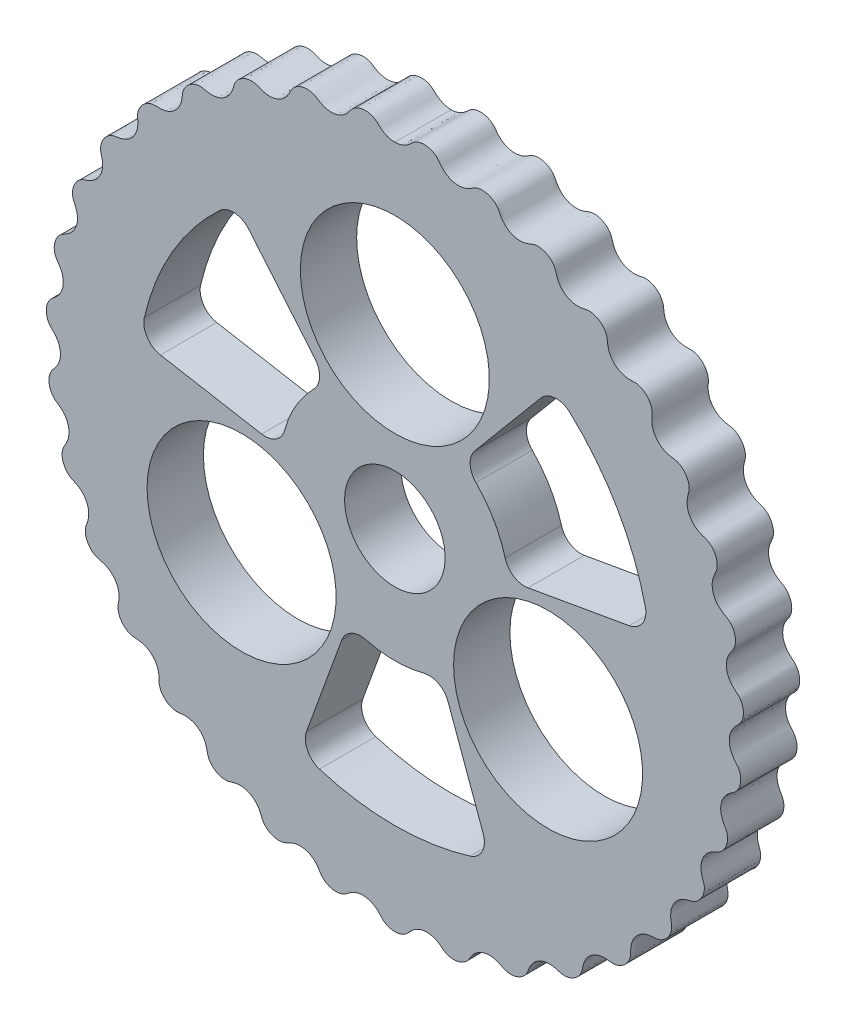
from build123d import *

# Parameters (mm, degrees)
BOSS_EXTRU_1_DEPTH           = 14
ENL_V_MAT_EXTRU_1_DEPTH      = 124.42138143
ENL_V_MAT_EXTRU_1_DEPTH_BACK = 124.42138143
ESQUISSE3_R                  = 12.5
ESQUISSE3_R_2                = 23.5


with BuildPart() as part:
    # Esquisse2 → Boss.-Extru.1 (new body)
    with BuildSketch(Plane.XY):
        with BuildLine():
            add(Edge.make_bspline(
                [(1e-09, 83.25), (0.040088824, 83.25), (0.120129435, 83.251061337), (0.267585323, 83.255837405), (0.462703618, 83.268563591), (0.645364707, 83.287627746), (0.825953715, 83.312999661), (1.053015758, 83.352548801), (1.323585204, 83.412444198), (1.633849565, 83.500181878), (1.981467864, 83.624321814), (2.319706006, 83.771485064), (2.662261899, 83.948181393), (3.005971372, 84.156358183), (3.348103017, 84.397162636), (3.685988397, 84.670610579), (4.008592319, 84.961802752), (4.321836079, 85.262578071), (4.647527428, 85.550888056), (5.00416229, 85.80082452), (5.420230989, 86.025743459), (5.895542579, 86.212908715), (6.56872817, 86.386645099), (7.441163645, 86.461499109), (8.31096741, 86.365542445), (9.139686188, 86.103782565), (9.742354143, 85.796005539), (10.150971365, 85.519911182), (10.493651783, 85.223730836), (10.774023962, 84.920522416), (11.02349314, 84.592216853), (11.266189819, 84.259279908), (11.583232815, 83.853055222), (11.978990072, 83.41447515), (12.475948016, 82.969917028), (13.236613444, 82.452632975), (14.231476492, 82.003960392), (15.316566452, 81.787292865), (16.425471427, 81.822980521), (17.371332617, 82.029422534), (18.031781326, 82.27473577), (18.590099136, 82.55866092), (19.058707362, 82.844515725), (19.424812003, 83.08639478), (19.797768015, 83.318657156), (20.194528645, 83.508944361), (20.646923696, 83.663433899), (21.152322405, 83.769311681), (21.852905271, 83.826753269), (22.733024109, 83.749513001), (23.579501632, 83.501749492), (24.354631314, 83.096153378), (24.903331276, 82.680179392), (25.270219184, 82.321521455), (25.570166919, 81.944583878), (25.804875176, 81.560289216), (26.0022721, 81.156523842), (26.200456977, 80.753476022), (26.417441773, 80.359742657), (26.659408377, 79.980820466), (27.043944341, 79.465530805), (27.623573402, 78.85957836), (28.494804468, 78.222841595), (29.550472496, 77.78603484), (30.539020285, 77.600802853), (31.351520301, 77.589184119), (31.930004105, 77.645832513), (32.444072119, 77.745989986), (32.893967914, 77.870153957), (33.33402857, 78.025317193), (33.765097494, 78.202941318), (34.194001399, 78.386098415), (34.6387147, 78.529805348), (35.134404455, 78.621743876), (35.674334892, 78.650260217), (36.403067544, 78.592270558), (37.275486637, 78.364225762), (38.205806208, 77.907245588), (38.961789042, 77.279081876), (39.44721498, 76.678331376), (39.736175831, 76.170073673), (39.895686332, 75.802983245), (40.017153344, 75.422023667), (40.123278131, 75.03704219), (40.266952736, 74.558710579), (40.52603309, 73.858369814), (40.998292492, 72.978406766), (41.799856099, 72.042062786), (42.915765728, 71.264158326), (44.088170393, 70.824770209), (45.098834121, 70.68453932), (45.907515146, 70.703534323), (46.503576132, 70.778964498), (46.975618019, 70.869128082), (47.443113881, 70.978260798), (47.916048892, 71.065998829), (48.43944974, 71.093542226), (49.003576105, 71.044012416), (49.755042598, 70.868238753), (50.610366574, 70.487726507), (51.467799376, 69.867511908), (52.111517426, 69.110718909), (52.484318801, 68.444428978), (52.68284929, 67.901497324), (52.77906692, 67.517497098), (52.83503762, 67.125910368), (52.870777297, 66.732510746), (52.923152924, 66.241358661), (53.043675087, 65.513213967), (53.333777617, 64.570142288), (53.93756528, 63.491699703), (54.775250645, 62.619966119), (55.630801731, 62.045619638), (56.36551236, 61.71532283), (56.923128601, 61.536890836), (57.447467895, 61.424449738), (57.930979273, 61.361975821), (58.417652562, 61.337451845), (58.904807507, 61.34335197), (59.390906455, 61.368187759), (59.878685487, 61.365811652), (60.398107488, 61.292640881), (60.936861168, 61.138826648), (61.62692939, 60.833061785), (62.368773024, 60.325452104), (63.070783729, 59.603766356), (63.599832645, 58.729641746), (63.864411541, 57.984269241), (63.966304107, 57.381112845), (63.984790029, 56.947011656), (63.969768225, 56.599995642), (63.940037008, 56.254191418), (63.913440028, 55.908139169), (63.89366939, 55.449772497), (63.907281987, 54.878978891), (63.995900239, 54.200692304), (64.209129067, 53.433584291), (64.591005855, 52.571629452), (65.20921762, 51.670333511), (66.0496679, 50.891803695), (66.977010041, 50.366395199), (67.765623933, 50.081199811), (68.363321294, 49.934399893), (68.848132122, 49.848790044), (69.335705709, 49.785087726), (69.821203649, 49.701160317), (70.326714826, 49.541891931), (70.837401665, 49.2974927), (71.472087998, 48.874778818), (72.167577664, 48.196074269), (72.704504093, 47.375491181), (73.050398197, 46.456289116), (73.180988144, 45.681862557), (73.192936086, 45.099857735), (73.123364105, 44.56054888), (72.995972368, 44.072709633), (72.863253803, 43.587050514), (72.756902125, 43.09415646), (72.669282446, 42.470109625), (72.645676872, 41.633534723), (72.792980571, 40.597385832), (73.246451733, 39.419706482), (74.026723602, 38.321842695), (74.945205601, 37.540235326), (75.877215276, 37.034082023), (76.730819728, 36.717716587), (77.466146094, 36.500920235), (78.227010447, 36.098063755), (78.94290159, 35.472632054), (79.582280339, 34.604590831), (79.985995888, 33.639305082), (80.161890124, 32.735499701), (80.167168005, 31.975334126), (80.092246376, 31.41625737), (79.949546775, 30.907612604), (79.754741271, 30.456911944), (79.539715603, 30.016508644), (79.343658601, 29.566803291), (79.13548163, 28.989859683), (78.977208113, 28.345311634), (78.896285201, 27.6362638), (78.924429639, 26.702747596), (79.101589924, 25.829390502), (79.4422354, 24.97534494), (79.946744448, 24.177461376), (80.468136684, 23.571467333), (80.985240033, 23.119511157), (81.454643896, 22.790508681), (81.848905188, 22.552451742), (82.153226287, 22.382870947), (82.459458217, 22.216808391), (82.759161309, 22.038729623), (83.113879052, 21.785019555), (83.564698722, 21.36810414), (84.044948452, 20.735775124), (84.482539297, 19.819008035), (84.69954113, 18.847352433), (84.72060122, 17.965362888), (84.608393743, 17.239032107), (84.45338458, 16.714643694), (84.243927867, 16.246368666), (83.992200308, 15.839401969), (83.70979725, 15.45442129), (83.437204302, 15.062284492), (83.187146159, 14.655095924), (82.967823992, 14.23035623), (82.76058648, 13.735848223), (82.585439327, 13.167212529), (82.433576786, 12.349587046), (82.424807012, 11.288794214), (82.683911379, 10.08245919), (83.25286204, 8.965055569), (83.878938115, 8.19727142), (84.420554291, 7.691678393), (84.802399117, 7.37549344), (85.112288731, 7.128236484), (85.410484748, 6.866174125), (85.680402423, 6.574613998), (86.027476828, 6.109583544), (86.38179352, 5.429952154), (86.661374327, 4.475010747), (86.708724976, 3.417349623), (86.557285936, 2.494770435), (86.293149173, 1.772499175), (86.026568983, 1.275144871), (85.718386004, 0.853504918), (85.387319394, 0.506870946), (85.03980125, 0.178128013), (84.704863354, -0.164064385), (84.313302332, -0.616928979), (83.850596733, -1.276908508), (83.407440773, -2.191982752), (83.124357518, -3.394471887), (83.144437709, -4.724873552), (83.459675641, -5.898887538), (83.912434778, -6.779301977), (84.351053976, -7.39691828), (84.687463888, -7.805611958), (84.966187651, -8.123982651), (85.234356775, -8.452174141), (85.466178553, -8.807518712), (85.670883953, -9.216198593), (85.837653454, -9.677064161), (85.98776599, -10.321989913), (86.046997252, -11.18412031), (85.935363479, -12.058352672), (85.649763823, -12.904302277), (85.299843782, -13.543163697), (84.981372193, -13.977711543), (84.634456039, -14.340996847), (84.272340311, -14.633852708), (83.885022582, -14.890732088), (83.500195172, -15.150932541), (83.128738169, -15.430574564), (82.777284268, -15.735109736), (82.410097918, -16.105949929), (82.043104054, -16.554016163), (81.602870496, -17.233571412), (81.189047964, -18.199749646), (80.959700668, -19.416788283), (81.048388588, -20.580355286), (81.294232045, -21.461273377), (81.548778859, -22.070318159), (81.729659438, -22.4375534), (81.929040397, -22.794886732), (82.138719094, -23.146055324), (82.338668927, -23.50328771), (82.502204312, -23.87923185), (82.635050876, -24.308707835), (82.724046056, -24.789997623), (82.765851459, -25.460257519), (82.677333698, -26.322526009), (82.420469218, -27.159041646), (82.004386069, -27.932062426), (81.573694516, -28.484349727), (81.209533758, -28.847842204), (80.833992576, -29.140890732), (80.459072082, -29.368332753), (80.061815494, -29.552559908), (79.659511492, -29.723896569), (79.263098568, -29.909282817), (78.877630401, -30.116676439), (78.442452719, -30.390664398), (77.972700817, -30.749743267), (77.357227429, -31.343029552), (76.711644179, -32.243524282), (76.218804032, -33.432674445), (76.072616869, -34.626592055), (76.143987091, -35.549226155), (76.279100857, -36.203086999), (76.388539038, -36.6022767), (76.519489397, -36.994763627), (76.663881626, -37.382271103), (76.802126975, -37.772313517), (76.903154417, -38.174291604), (76.963765591, -38.624872268), (76.970951564, -39.11982101), (76.897529174, -39.795118636), (76.660950158, -40.632541654), (76.263375149, -41.412085348), (75.72245722, -42.099226739), (75.209868062, -42.565111479), (74.794394294, -42.859137038), (74.379917505, -43.083461154), (73.977084979, -43.244948428), (73.558923633, -43.359302593), (73.136800287, -43.454735795), (72.612336729, -43.588870606), (71.852215082, -43.84232507), (70.902619737, -44.328733319), (69.883792778, -45.195235822), (69.157061734, -46.28056915), (68.76508556, -47.324874381), (68.594921359, -48.270625801), (68.567778889, -48.969519666), (68.613962003, -49.589691806), (68.694786044, -50.128766728), (68.773267701, -50.557413337), (68.836496503, -50.989230511), (68.850886571, -51.426003165), (68.81129709, -51.899001144), (68.707087309, -52.400986137), (68.482323379, -53.061598032), (68.065278708, -53.832841019), (67.507335071, -54.506959451), (66.834400533, -55.055147385), (66.248760448, -55.389010238), (65.795647233, -55.578972256), (65.361860162, -55.703145356), (64.956181538, -55.772161862), (64.443866036, -55.807373871), (63.931172762, -55.827974159), (63.420145107, -55.884524011), (62.668834416, -56.030036466), (61.796234483, -56.315916411), (60.777986256, -56.890035252), (59.893659002, -57.758519579), (59.321571212, -58.638865687), (59.002346622, -59.379857825), (58.834055279, -59.931858669), (58.729559464, -60.441272399), (58.671101197, -60.900926585), (58.643855067, -61.363419424), (58.639589466, -61.826248627), (58.637608794, -62.289393757), (58.590409594, -62.751064883), (58.47655898, -63.23844213), (58.288134252, -63.741108028), (57.947060621, -64.381759389), (57.397609467, -65.084028086), (56.72844525, -65.657465727), (55.974494281, -66.081886689), (55.350535039, -66.310959662), (54.871806721, -66.424375627), (54.415980045, -66.476915586), (53.990077178, -66.477027239), (53.567027886, -66.43223532), (53.146149552, -66.374980758), (52.617547652, -66.320457712), (52.024831468, -66.302552842), (51.371538855, -66.352910193), (50.506679972, -66.533412989), (49.559166069, -66.89955859), (48.702108462, -67.459958152), (47.983129465, -68.187220398), (47.523373132, -68.84297049), (47.246964686, -69.348229432), (47.041025691, -69.827817194), (46.890269659, -70.271287638), (46.771964625, -70.724311575), (46.678819225, -71.182929082), (46.597211298, -71.643604056), (46.481172827, -72.097836795), (46.292138209, -72.571163752), (46.021824306, -73.050075572), (45.568761197, -73.645903655), (44.890222196, -74.263849266), (43.98905763, -74.797689653), (42.94746495, -75.115435619), (42.077464738, -75.177152086), (41.399248352, -75.086743744), (40.919544318, -74.952994273), (40.541050674, -74.830321547), (40.064807021, -74.686100724), (39.34103762, -74.514604771), (38.350893535, -74.419455578), (37.074520732, -74.571442192), (35.888721468, -75.052607731), (34.975698329, -75.699195424), (34.364450703, -76.334250239), (33.996294353, -76.821705461), (33.717733349, -77.275455177), (33.509077341, -77.679329947), (33.327021242, -78.095806944), (33.164723663, -78.519896193), (33.001563278, -78.94406372), (32.796656033, -79.350658682), (32.522823625, -79.758336134), (32.176119273, -80.155081713), (31.642523598, -80.627231096), (30.892052867, -81.090036542), (29.939862838, -81.443918664), (28.982545679, -81.56293214), (28.223855785, -81.509746348), (27.662910254, -81.379274614), (27.29013254, -81.250373055), (26.933001632, -81.083581168), (26.586085422, -80.897631599), (26.149349906, -80.67078978), (25.478937262, -80.369066932), (24.537228785, -80.088216925), (23.307663963, -79.990838846), (22.118338742, -80.201733299), (21.164294245, -80.593602961), (20.375220631, -81.087273774), (19.832279629, -81.546660398), (19.385274321, -82.034157122), (19.021479045, -82.525340001), (18.756127919, -82.935963458), (18.508085715, -83.356669889), (18.23834038, -83.765058711), (17.891785818, -84.16123741), (17.466514062, -84.529044784), (16.830210216, -84.939795759), (16.063344263, -85.254591828), (15.22012652, -85.433382801), (14.32799274, -85.451837247), (13.568915493, -85.344226448), (12.872967316, -85.118520656), (12.262220894, -84.783351141), (11.749872351, -84.371212326), (11.259348298, -83.991245968), (10.73794288, -83.651801139), (10.185577467, -83.366248058), (9.605089875, -83.142087795), (9.003129514, -82.984559577), (8.214241107, -82.872388745), (7.405176449, -82.88676343), (6.599602357, -83.034120338), (5.741072926, -83.342141719), (5.114760944, -83.673731768), (4.568925645, -84.060173336), (4.099612111, -84.477542208), (3.749044233, -84.837510854), (3.418552905, -85.215066553), (3.081505747, -85.587765386), (2.731768166, -85.886441779), (2.386291749, -86.116835583), (2.059146739, -86.292339371), (1.759522327, -86.424357783), (1.489580283, -86.520234495), (1.2539302, -86.588522689), (1.015010104, -86.645781378), (0.813542031, -86.684340968), (0.614912199, -86.713791418), (0.408551575, -86.734163691), (0.233446381, -86.745023828), (0.106617179, -86.749095241), (0.035572526, -86.75), (0, -86.75)],
                knots=[0.066501337, 0.066501337, 0.066501337, 0.066501337, 0.066501337, 0.067030786, 0.067560235, 0.068089684, 0.068619133, 0.069148582, 0.069678031, 0.070736929, 0.071795827, 0.072854725, 0.073913623, 0.074972521, 0.076220363, 0.077468205, 0.078716047, 0.079963889, 0.081211731, 0.082459573, 0.083707415, 0.084955257, 0.086634783, 0.088314308, 0.091673359, 0.09495824, 0.09660068, 0.098243121, 0.099426856, 0.100610592, 0.101794327, 0.102978063, 0.104161798, 0.105345534, 0.107713005, 0.109756077, 0.11179915, 0.115885295, 0.12016899, 0.122310837, 0.124452685, 0.126974339, 0.128235166, 0.129495993, 0.13075682, 0.132017647, 0.133278474, 0.134539302, 0.136237378, 0.137935454, 0.141331606, 0.144630776, 0.146280361, 0.147929945, 0.149220372, 0.1505108, 0.151801227, 0.153091654, 0.154382081, 0.155672508, 0.156962935, 0.158253362, 0.161761518, 0.165269673, 0.169256048, 0.171249236, 0.173242423, 0.174581734, 0.175921046, 0.177260357, 0.178599668, 0.179938979, 0.181278291, 0.182617602, 0.183956913, 0.185715154, 0.187473395, 0.190989878, 0.194252137, 0.197514396, 0.19866182, 0.199809244, 0.200956667, 0.202104091, 0.203251515, 0.204398938, 0.206693785, 0.210674514, 0.214655242, 0.218406661, 0.222158079, 0.224917175, 0.226296724, 0.227676272, 0.22905582, 0.230435368, 0.231814916, 0.233194465, 0.235057963, 0.236921461, 0.240648458, 0.243873619, 0.247098781, 0.248233673, 0.249368566, 0.250503458, 0.25163835, 0.252773242, 0.253908134, 0.256177919, 0.260110274, 0.26404263, 0.267959112, 0.269917354, 0.271875595, 0.273274219, 0.274672842, 0.276071466, 0.277470089, 0.278868713, 0.280267337, 0.28166596, 0.283064584, 0.284875183, 0.286685782, 0.29030698, 0.293323427, 0.296339874, 0.298333861, 0.299330855, 0.300327848, 0.301324842, 0.302321835, 0.303318829, 0.304315822, 0.306594796, 0.308873769, 0.311152743, 0.313431716, 0.317387723, 0.32134373, 0.324169909, 0.325582999, 0.326996088, 0.328409178, 0.329822268, 0.331235357, 0.332648447, 0.334477645, 0.336306843, 0.33996524, 0.343736076, 0.345621494, 0.347506912, 0.348953761, 0.35040061, 0.351847459, 0.353294308, 0.354741157, 0.356188006, 0.359081704, 0.362879335, 0.366676967, 0.370537807, 0.374398648, 0.376596104, 0.37879356, 0.380991016, 0.383188472, 0.386406137, 0.389623802, 0.393269885, 0.395092927, 0.396915969, 0.398324235, 0.399732501, 0.401140767, 0.402549033, 0.403957299, 0.405365565, 0.408182097, 0.410153537, 0.412124976, 0.416067856, 0.418355936, 0.420644016, 0.422932097, 0.425220177, 0.426220887, 0.427221596, 0.428222306, 0.429223015, 0.430223725, 0.431224434, 0.433225853, 0.436253956, 0.439282058, 0.442804394, 0.444565561, 0.446326729, 0.447698255, 0.44906978, 0.450441306, 0.451812832, 0.453184357, 0.454555883, 0.455927408, 0.457298934, 0.459338214, 0.461377494, 0.465456054, 0.469404559, 0.473353064, 0.475631132, 0.476770166, 0.4779092, 0.479048235, 0.480187269, 0.481326303, 0.482465337, 0.48570288, 0.488940423, 0.49265461, 0.494511704, 0.496368797, 0.49774343, 0.499118063, 0.500492695, 0.501867328, 0.503241961, 0.504616594, 0.507365859, 0.511104367, 0.514842875, 0.518670795, 0.522498716, 0.524930609, 0.526146555, 0.527362502, 0.528578448, 0.529794394, 0.531010341, 0.532226287, 0.533819427, 0.535412567, 0.538598846, 0.542102883, 0.543854902, 0.545606921, 0.546941465, 0.54827601, 0.549610554, 0.550945099, 0.552279643, 0.553614188, 0.554948732, 0.556283277, 0.558269429, 0.560255581, 0.564227886, 0.568282181, 0.572336476, 0.573511572, 0.574686668, 0.575861764, 0.57703686, 0.578211956, 0.579387052, 0.580562148, 0.581737244, 0.583367239, 0.584997234, 0.588257225, 0.591641053, 0.593332967, 0.595024881, 0.596281361, 0.59753784, 0.59879432, 0.600050799, 0.601307279, 0.602563758, 0.603820238, 0.605076717, 0.607210573, 0.609344429, 0.61361214, 0.617714162, 0.621816183, 0.623004276, 0.62419237, 0.625380463, 0.626568556, 0.627756649, 0.628944742, 0.630132836, 0.631320929, 0.632969564, 0.6346182, 0.637915471, 0.641262075, 0.642935376, 0.644608678, 0.645852233, 0.647095787, 0.648339342, 0.649582897, 0.650826452, 0.652070006, 0.654557116, 0.658776575, 0.662996034, 0.667247711, 0.669373549, 0.671499388, 0.674003689, 0.67525584, 0.67650799, 0.677760141, 0.679012292, 0.680264442, 0.681516593, 0.683202323, 0.684888053, 0.688259513, 0.691531966, 0.693168193, 0.694804419, 0.695983822, 0.697163225, 0.698342627, 0.69952203, 0.701880835, 0.703060238, 0.70423964, 0.708309876, 0.712380112, 0.716338335, 0.718317447, 0.720296558, 0.721626341, 0.722956124, 0.724285907, 0.72561569, 0.726945472, 0.728275255, 0.729605038, 0.730934821, 0.732680588, 0.734426356, 0.737917891, 0.741116125, 0.742715242, 0.744314359, 0.745534974, 0.746755589, 0.747976204, 0.74919682, 0.750417435, 0.75163805, 0.75407928, 0.756000656, 0.757922032, 0.761764784, 0.76568184, 0.767640368, 0.769598896, 0.770942863, 0.772286829, 0.773630795, 0.774974762, 0.776318728, 0.777662694, 0.77900666, 0.780350627, 0.782157021, 0.783963414, 0.787576202, 0.790826112, 0.794076022, 0.796362446, 0.797505657, 0.798648869, 0.799792081, 0.800935292, 0.803221716, 0.807186345, 0.811150975, 0.815545486, 0.817742741, 0.819939996, 0.821244698, 0.822549399, 0.8238541, 0.825158801, 0.826463502, 0.827768204, 0.829072905, 0.830377606, 0.832091813, 0.833806021, 0.837234435, 0.840447205, 0.843659974, 0.844790762, 0.845921549, 0.847052336, 0.848183123, 0.84931391, 0.850444698, 0.852706272, 0.856622453, 0.860538634, 0.864468338, 0.86643319, 0.868398042, 0.871204929, 0.872608373, 0.874011817, 0.87541526, 0.876818704, 0.878222148, 0.879625591, 0.881442433, 0.883259274, 0.886892958, 0.889085186, 0.891277414, 0.893469642, 0.895661871, 0.897445183, 0.899228495, 0.901011808, 0.90279512, 0.904578432, 0.906361744, 0.908145057, 0.909928369, 0.913713678, 0.915606332, 0.917498987, 0.920382828, 0.921824749, 0.92326667, 0.924708591, 0.926150512, 0.927592432, 0.929034353, 0.929973959, 0.930913564, 0.93185317, 0.932792775, 0.933262578, 0.933732381, 0.934671986, 0.935141789, 0.935611592, 0.936081395, 0.936551197, 0.936551197, 0.936551197, 0.936551197, 0.936551197], degree=4))
            add(Edge.make_bspline(
                [(1e-09, 83.25), (-0.040088823, 83.25), (-0.120129435, 83.251061337), (-0.267585323, 83.255837405), (-0.462703617, 83.268563591), (-0.645364706, 83.287627746), (-0.825953715, 83.312999661), (-1.053015757, 83.352548801), (-1.323585203, 83.412444198), (-1.633849564, 83.500181878), (-1.981467864, 83.624321814), (-2.319706005, 83.771485064), (-2.662261898, 83.948181393), (-3.005971371, 84.156358183), (-3.348103016, 84.397162636), (-3.685988396, 84.670610579), (-4.008592318, 84.961802752), (-4.321836079, 85.262578071), (-4.647527428, 85.550888056), (-5.004162289, 85.80082452), (-5.420230989, 86.025743459), (-5.895542578, 86.212908715), (-6.568728169, 86.386645099), (-7.441163644, 86.461499109), (-8.310967409, 86.365542445), (-9.139686187, 86.103782565), (-9.742354142, 85.796005539), (-10.150971364, 85.519911182), (-10.493651782, 85.223730836), (-10.774023961, 84.920522416), (-11.023493139, 84.592216853), (-11.266189818, 84.259279908), (-11.583232814, 83.853055222), (-11.978990071, 83.41447515), (-12.475948015, 82.969917028), (-13.236613443, 82.452632975), (-14.231476491, 82.003960392), (-15.316566452, 81.787292865), (-16.425471427, 81.822980521), (-17.371332616, 82.029422534), (-18.031781325, 82.27473577), (-18.590099135, 82.55866092), (-19.058707361, 82.844515725), (-19.424812002, 83.08639478), (-19.797768014, 83.318657156), (-20.194528644, 83.508944361), (-20.646923695, 83.663433899), (-21.152322404, 83.769311681), (-21.85290527, 83.826753269), (-22.733024108, 83.749513001), (-23.579501631, 83.501749492), (-24.354631313, 83.096153378), (-24.903331276, 82.680179392), (-25.270219183, 82.321521455), (-25.570166918, 81.944583878), (-25.804875175, 81.560289216), (-26.0022721, 81.156523842), (-26.200456976, 80.753476022), (-26.417441772, 80.359742657), (-26.659408377, 79.980820466), (-27.04394434, 79.465530805), (-27.623573401, 78.85957836), (-28.494804467, 78.222841595), (-29.550472495, 77.78603484), (-30.539020284, 77.600802853), (-31.3515203, 77.589184119), (-31.930004105, 77.645832513), (-32.444072118, 77.745989986), (-32.893967913, 77.870153957), (-33.334028569, 78.025317193), (-33.765097493, 78.202941318), (-34.194001399, 78.386098415), (-34.638714699, 78.529805348), (-35.134404454, 78.621743876), (-35.674334891, 78.650260217), (-36.403067543, 78.592270558), (-37.275486636, 78.364225762), (-38.205806207, 77.907245588), (-38.961789041, 77.279081876), (-39.447214979, 76.678331376), (-39.73617583, 76.170073673), (-39.895686331, 75.802983245), (-40.017153343, 75.422023667), (-40.12327813, 75.03704219), (-40.266952735, 74.558710579), (-40.52603309, 73.858369814), (-40.998292492, 72.978406766), (-41.799856098, 72.042062786), (-42.915765728, 71.264158326), (-44.088170392, 70.824770209), (-45.09883412, 70.68453932), (-45.907515145, 70.703534323), (-46.503576131, 70.778964498), (-46.975618018, 70.869128082), (-47.443113881, 70.978260798), (-47.916048891, 71.065998829), (-48.439449739, 71.093542226), (-49.003576104, 71.044012416), (-49.755042597, 70.868238753), (-50.610366574, 70.487726508), (-51.467799375, 69.867511908), (-52.111517426, 69.110718909), (-52.4843188, 68.444428978), (-52.68284929, 67.901497324), (-52.779066919, 67.517497098), (-52.835037619, 67.125910368), (-52.870777296, 66.732510746), (-52.923152923, 66.241358661), (-53.043675087, 65.513213967), (-53.333777617, 64.570142288), (-53.937565279, 63.491699703), (-54.775250644, 62.619966119), (-55.63080173, 62.045619638), (-56.365512359, 61.71532283), (-56.9231286, 61.536890836), (-57.447467894, 61.424449738), (-57.930979272, 61.361975821), (-58.417652561, 61.337451845), (-58.904807506, 61.34335197), (-59.390906454, 61.368187759), (-59.878685487, 61.365811653), (-60.398107487, 61.292640881), (-60.936861167, 61.138826648), (-61.626929389, 60.833061785), (-62.368773023, 60.325452104), (-63.070783728, 59.603766356), (-63.599832644, 58.729641746), (-63.864411541, 57.984269241), (-63.966304106, 57.381112845), (-63.984790028, 56.947011656), (-63.969768224, 56.599995642), (-63.940037007, 56.254191418), (-63.913440027, 55.908139169), (-63.893669389, 55.449772497), (-63.907281986, 54.878978891), (-63.995900238, 54.200692304), (-64.209129066, 53.433584291), (-64.591005854, 52.571629452), (-65.209217619, 51.670333511), (-66.049667899, 50.891803695), (-66.97701004, 50.366395199), (-67.765623932, 50.081199811), (-68.363321293, 49.934399893), (-68.848132121, 49.848790044), (-69.335705708, 49.785087726), (-69.821203648, 49.701160317), (-70.326714825, 49.541891931), (-70.837401665, 49.2974927), (-71.472087997, 48.874778818), (-72.167577663, 48.19607427), (-72.704504092, 47.375491181), (-73.050398196, 46.456289116), (-73.180988143, 45.681862557), (-73.192936085, 45.099857735), (-73.123364105, 44.56054888), (-72.995972367, 44.072709633), (-72.863253802, 43.587050514), (-72.756902124, 43.09415646), (-72.669282446, 42.470109625), (-72.645676871, 41.633534723), (-72.79298057, 40.597385832), (-73.246451732, 39.419706482), (-74.026723601, 38.321842695), (-74.9452056, 37.540235326), (-75.877215276, 37.034082023), (-76.730819727, 36.717716587), (-77.466146093, 36.500920235), (-78.227010446, 36.098063755), (-78.942901589, 35.472632054), (-79.582280338, 34.604590831), (-79.985995887, 33.639305083), (-80.161890123, 32.735499701), (-80.167168004, 31.975334126), (-80.092246375, 31.41625737), (-79.949546774, 30.907612604), (-79.75474127, 30.456911945), (-79.539715602, 30.016508644), (-79.3436586, 29.566803291), (-79.135481629, 28.989859683), (-78.977208112, 28.345311634), (-78.896285201, 27.636263801), (-78.924429638, 26.702747596), (-79.101589924, 25.829390502), (-79.442235399, 24.97534494), (-79.946744448, 24.177461376), (-80.468136683, 23.571467333), (-80.985240032, 23.119511157), (-81.454643895, 22.790508681), (-81.848905187, 22.552451742), (-82.153226286, 22.382870947), (-82.459458217, 22.216808391), (-82.759161308, 22.038729624), (-83.113879051, 21.785019555), (-83.564698721, 21.368104141), (-84.044948451, 20.735775124), (-84.482539296, 19.819008035), (-84.699541129, 18.847352433), (-84.720601219, 17.965362888), (-84.608393742, 17.239032107), (-84.453384579, 16.714643694), (-84.243927866, 16.246368667), (-83.992200308, 15.839401969), (-83.709797249, 15.45442129), (-83.437204301, 15.062284492), (-83.187146158, 14.655095924), (-82.967823992, 14.23035623), (-82.760586479, 13.735848223), (-82.585439327, 13.167212529), (-82.433576786, 12.349587046), (-82.424807012, 11.288794214), (-82.683911378, 10.08245919), (-83.252862039, 8.965055569), (-83.878938115, 8.19727142), (-84.42055429, 7.691678394), (-84.802399116, 7.37549344), (-85.11228873, 7.128236484), (-85.410484747, 6.866174125), (-85.680402422, 6.574613998), (-86.027476827, 6.109583544), (-86.381793519, 5.429952154), (-86.661374326, 4.475010747), (-86.708724975, 3.417349623), (-86.557285936, 2.494770435), (-86.293149172, 1.772499175), (-86.026568982, 1.275144871), (-85.718386004, 0.853504918), (-85.387319393, 0.506870946), (-85.039801249, 0.178128013), (-84.704863353, -0.164064385), (-84.313302331, -0.616928979), (-83.850596732, -1.276908508), (-83.407440773, -2.191982752), (-83.124357517, -3.394471887), (-83.144437708, -4.724873552), (-83.45967564, -5.898887538), (-83.912434777, -6.779301977), (-84.351053975, -7.39691828), (-84.687463888, -7.805611957), (-84.96618765, -8.123982651), (-85.234356775, -8.452174141), (-85.466178552, -8.807518712), (-85.670883952, -9.216198593), (-85.837653453, -9.677064161), (-85.98776599, -10.321989913), (-86.046997251, -11.184120309), (-85.935363479, -12.058352672), (-85.649763822, -12.904302277), (-85.299843781, -13.543163697), (-84.981372193, -13.977711543), (-84.634456038, -14.340996847), (-84.272340311, -14.633852708), (-83.885022581, -14.890732088), (-83.500195171, -15.150932541), (-83.128738168, -15.430574564), (-82.777284267, -15.735109736), (-82.410097917, -16.105949929), (-82.043104053, -16.554016163), (-81.602870495, -17.233571412), (-81.189047964, -18.199749646), (-80.959700667, -19.416788283), (-81.048388587, -20.580355286), (-81.294232044, -21.461273377), (-81.548778858, -22.070318159), (-81.729659437, -22.4375534), (-81.929040397, -22.794886732), (-82.138719093, -23.146055324), (-82.338668926, -23.503287709), (-82.502204311, -23.87923185), (-82.635050875, -24.308707835), (-82.724046055, -24.789997623), (-82.765851458, -25.460257518), (-82.677333697, -26.322526009), (-82.420469217, -27.159041646), (-82.004386068, -27.932062426), (-81.573694516, -28.484349727), (-81.209533757, -28.847842204), (-80.833992575, -29.140890732), (-80.459072081, -29.368332753), (-80.061815493, -29.552559908), (-79.659511491, -29.723896568), (-79.263098567, -29.909282817), (-78.8776304, -30.116676439), (-78.442452718, -30.390664398), (-77.972700816, -30.749743267), (-77.357227428, -31.343029551), (-76.711644178, -32.243524282), (-76.218804031, -33.432674445), (-76.072616869, -34.626592055), (-76.14398709, -35.549226155), (-76.279100856, -36.203086999), (-76.388539037, -36.6022767), (-76.519489397, -36.994763627), (-76.663881625, -37.382271103), (-76.802126974, -37.772313517), (-76.903154416, -38.174291604), (-76.96376559, -38.624872268), (-76.970951564, -39.11982101), (-76.897529173, -39.795118636), (-76.660950157, -40.632541654), (-76.263375148, -41.412085348), (-75.722457219, -42.099226739), (-75.209868061, -42.565111479), (-74.794394293, -42.859137038), (-74.379917505, -43.083461154), (-73.977084978, -43.244948428), (-73.558923632, -43.359302593), (-73.136800286, -43.454735795), (-72.612336728, -43.588870606), (-71.852215081, -43.84232507), (-70.902619737, -44.328733319), (-69.883792777, -45.195235822), (-69.157061733, -46.28056915), (-68.765085559, -47.324874381), (-68.594921358, -48.270625801), (-68.567778889, -48.969519666), (-68.613962003, -49.589691806), (-68.694786043, -50.128766728), (-68.773267701, -50.557413337), (-68.836496502, -50.989230511), (-68.85088657, -51.426003165), (-68.811297089, -51.899001144), (-68.707087308, -52.400986137), (-68.482323378, -53.061598032), (-68.065278707, -53.832841019), (-67.50733507, -54.506959451), (-66.834400533, -55.055147385), (-66.248760448, -55.389010238), (-65.795647232, -55.578972256), (-65.361860161, -55.703145356), (-64.956181537, -55.772161862), (-64.443866035, -55.807373871), (-63.931172762, -55.827974159), (-63.420145107, -55.884524011), (-62.668834416, -56.030036466), (-61.796234483, -56.315916411), (-60.777986255, -56.890035252), (-59.893659001, -57.758519579), (-59.321571212, -58.638865687), (-59.002346622, -59.379857825), (-58.834055278, -59.931858669), (-58.729559463, -60.441272399), (-58.671101196, -60.900926585), (-58.643855066, -61.363419424), (-58.639589466, -61.826248627), (-58.637608794, -62.289393757), (-58.590409593, -62.751064883), (-58.476558979, -63.23844213), (-58.288134251, -63.741108028), (-57.94706062, -64.381759389), (-57.397609466, -65.084028086), (-56.72844525, -65.657465727), (-55.97449428, -66.081886689), (-55.350535039, -66.310959662), (-54.87180672, -66.424375627), (-54.415980044, -66.476915586), (-53.990077178, -66.477027239), (-53.567027885, -66.432235319), (-53.146149551, -66.374980758), (-52.617547651, -66.320457712), (-52.024831468, -66.302552842), (-51.371538854, -66.352910193), (-50.506679971, -66.533412989), (-49.559166069, -66.89955859), (-48.702108461, -67.459958152), (-47.983129464, -68.187220397), (-47.523373131, -68.84297049), (-47.246964685, -69.348229432), (-47.04102569, -69.827817194), (-46.890269658, -70.271287638), (-46.771964624, -70.724311575), (-46.678819224, -71.182929082), (-46.597211297, -71.643604056), (-46.481172826, -72.097836795), (-46.292138209, -72.571163752), (-46.021824306, -73.050075572), (-45.568761197, -73.645903655), (-44.890222196, -74.263849266), (-43.989057629, -74.797689653), (-42.94746495, -75.115435619), (-42.077464737, -75.177152086), (-41.399248352, -75.086743744), (-40.919544317, -74.952994273), (-40.541050673, -74.830321547), (-40.064807021, -74.686100724), (-39.341037619, -74.514604771), (-38.350893534, -74.419455578), (-37.074520731, -74.571442192), (-35.888721468, -75.052607731), (-34.975698329, -75.699195424), (-34.364450702, -76.334250239), (-33.996294352, -76.821705461), (-33.717733348, -77.275455177), (-33.50907734, -77.679329947), (-33.327021241, -78.095806944), (-33.164723662, -78.519896193), (-33.001563278, -78.94406372), (-32.796656032, -79.350658682), (-32.522823625, -79.758336134), (-32.176119273, -80.155081713), (-31.642523598, -80.627231096), (-30.892052867, -81.090036542), (-29.939862837, -81.443918664), (-28.982545678, -81.562932139), (-28.223855784, -81.509746348), (-27.662910253, -81.379274614), (-27.290132539, -81.250373055), (-26.933001631, -81.083581168), (-26.586085422, -80.897631599), (-26.149349905, -80.67078978), (-25.478937261, -80.369066932), (-24.537228785, -80.088216925), (-23.307663963, -79.990838846), (-22.118338741, -80.201733299), (-21.164294245, -80.593602961), (-20.37522063, -81.087273774), (-19.832279628, -81.546660398), (-19.385274321, -82.034157122), (-19.021479044, -82.525340001), (-18.756127919, -82.935963458), (-18.508085714, -83.356669889), (-18.238340379, -83.765058711), (-17.891785818, -84.16123741), (-17.466514061, -84.529044784), (-16.830210216, -84.939795759), (-16.063344263, -85.254591828), (-15.220126519, -85.433382801), (-14.32799274, -85.451837247), (-13.568915492, -85.344226448), (-12.872967315, -85.118520656), (-12.262220894, -84.783351141), (-11.749872351, -84.371212326), (-11.259348297, -83.991245968), (-10.737942879, -83.651801139), (-10.185577466, -83.366248058), (-9.605089874, -83.142087795), (-9.003129513, -82.984559577), (-8.214241106, -82.872388745), (-7.405176448, -82.88676343), (-6.599602356, -83.034120338), (-5.741072925, -83.342141719), (-5.114760943, -83.673731768), (-4.568925644, -84.060173336), (-4.099612111, -84.477542208), (-3.749044232, -84.837510854), (-3.418552904, -85.215066553), (-3.081505747, -85.587765386), (-2.731768165, -85.886441779), (-2.386291749, -86.116835583), (-2.059146738, -86.292339371), (-1.759522326, -86.424357783), (-1.489580282, -86.520234495), (-1.2539302, -86.588522689), (-1.015010103, -86.645781378), (-0.813542031, -86.684340968), (-0.614912199, -86.713791418), (-0.408551574, -86.734163691), (-0.23344638, -86.745023828), (-0.106617179, -86.749095241), (-0.035572526, -86.75), (0, -86.75)],
                knots=[0.066501337, 0.066501337, 0.066501337, 0.066501337, 0.066501337, 0.067030786, 0.067560235, 0.068089684, 0.068619133, 0.069148582, 0.069678031, 0.070736929, 0.071795827, 0.072854725, 0.073913623, 0.074972521, 0.076220363, 0.077468205, 0.078716047, 0.079963889, 0.081211731, 0.082459573, 0.083707415, 0.084955257, 0.086634783, 0.088314308, 0.091673359, 0.09495824, 0.09660068, 0.098243121, 0.099426856, 0.100610592, 0.101794327, 0.102978063, 0.104161798, 0.105345534, 0.107713005, 0.109756077, 0.11179915, 0.115885295, 0.12016899, 0.122310837, 0.124452685, 0.126974339, 0.128235166, 0.129495993, 0.13075682, 0.132017647, 0.133278474, 0.134539302, 0.136237378, 0.137935454, 0.141331606, 0.144630776, 0.146280361, 0.147929945, 0.149220372, 0.1505108, 0.151801227, 0.153091654, 0.154382081, 0.155672508, 0.156962935, 0.158253362, 0.161761518, 0.165269673, 0.169256048, 0.171249236, 0.173242423, 0.174581734, 0.175921046, 0.177260357, 0.178599668, 0.179938979, 0.181278291, 0.182617602, 0.183956913, 0.185715154, 0.187473395, 0.190989878, 0.194252137, 0.197514396, 0.19866182, 0.199809244, 0.200956667, 0.202104091, 0.203251515, 0.204398938, 0.206693785, 0.210674514, 0.214655242, 0.218406661, 0.222158079, 0.224917175, 0.226296724, 0.227676272, 0.22905582, 0.230435368, 0.231814916, 0.233194465, 0.235057963, 0.236921461, 0.240648458, 0.243873619, 0.247098781, 0.248233673, 0.249368566, 0.250503458, 0.25163835, 0.252773242, 0.253908134, 0.256177919, 0.260110274, 0.26404263, 0.267959112, 0.269917354, 0.271875595, 0.273274219, 0.274672842, 0.276071466, 0.277470089, 0.278868713, 0.280267337, 0.28166596, 0.283064584, 0.284875183, 0.286685782, 0.29030698, 0.293323427, 0.296339874, 0.298333861, 0.299330855, 0.300327848, 0.301324842, 0.302321835, 0.303318829, 0.304315822, 0.306594796, 0.308873769, 0.311152743, 0.313431716, 0.317387723, 0.32134373, 0.324169909, 0.325582999, 0.326996088, 0.328409178, 0.329822268, 0.331235357, 0.332648447, 0.334477645, 0.336306843, 0.33996524, 0.343736076, 0.345621494, 0.347506912, 0.348953761, 0.35040061, 0.351847459, 0.353294308, 0.354741157, 0.356188006, 0.359081704, 0.362879335, 0.366676967, 0.370537807, 0.374398648, 0.376596104, 0.37879356, 0.380991016, 0.383188472, 0.386406137, 0.389623802, 0.393269885, 0.395092927, 0.396915969, 0.398324235, 0.399732501, 0.401140767, 0.402549033, 0.403957299, 0.405365565, 0.408182097, 0.410153537, 0.412124976, 0.416067856, 0.418355936, 0.420644016, 0.422932097, 0.425220177, 0.426220887, 0.427221596, 0.428222306, 0.429223015, 0.430223725, 0.431224434, 0.433225853, 0.436253956, 0.439282058, 0.442804394, 0.444565561, 0.446326729, 0.447698255, 0.44906978, 0.450441306, 0.451812832, 0.453184357, 0.454555883, 0.455927408, 0.457298934, 0.459338214, 0.461377494, 0.465456054, 0.469404559, 0.473353064, 0.475631132, 0.476770166, 0.4779092, 0.479048235, 0.480187269, 0.481326303, 0.482465337, 0.48570288, 0.488940423, 0.49265461, 0.494511704, 0.496368797, 0.49774343, 0.499118063, 0.500492695, 0.501867328, 0.503241961, 0.504616594, 0.507365859, 0.511104367, 0.514842875, 0.518670795, 0.522498716, 0.524930609, 0.526146555, 0.527362502, 0.528578448, 0.529794394, 0.531010341, 0.532226287, 0.533819427, 0.535412567, 0.538598846, 0.542102883, 0.543854902, 0.545606921, 0.546941465, 0.54827601, 0.549610554, 0.550945099, 0.552279643, 0.553614188, 0.554948732, 0.556283277, 0.558269429, 0.560255581, 0.564227886, 0.568282181, 0.572336476, 0.573511572, 0.574686668, 0.575861764, 0.57703686, 0.578211956, 0.579387052, 0.580562148, 0.581737244, 0.583367239, 0.584997234, 0.588257225, 0.591641053, 0.593332967, 0.595024881, 0.596281361, 0.59753784, 0.59879432, 0.600050799, 0.601307279, 0.602563758, 0.603820238, 0.605076717, 0.607210573, 0.609344429, 0.61361214, 0.617714162, 0.621816183, 0.623004276, 0.62419237, 0.625380463, 0.626568556, 0.627756649, 0.628944742, 0.630132836, 0.631320929, 0.632969564, 0.6346182, 0.637915471, 0.641262075, 0.642935376, 0.644608678, 0.645852233, 0.647095787, 0.648339342, 0.649582897, 0.650826452, 0.652070006, 0.654557116, 0.658776575, 0.662996034, 0.667247711, 0.669373549, 0.671499388, 0.674003689, 0.67525584, 0.67650799, 0.677760141, 0.679012292, 0.680264442, 0.681516593, 0.683202323, 0.684888053, 0.688259513, 0.691531966, 0.693168193, 0.694804419, 0.695983822, 0.697163225, 0.698342627, 0.69952203, 0.701880835, 0.703060238, 0.70423964, 0.708309876, 0.712380112, 0.716338335, 0.718317447, 0.720296558, 0.721626341, 0.722956124, 0.724285907, 0.72561569, 0.726945472, 0.728275255, 0.729605038, 0.730934821, 0.732680588, 0.734426356, 0.737917891, 0.741116125, 0.742715242, 0.744314359, 0.745534974, 0.746755589, 0.747976204, 0.74919682, 0.750417435, 0.75163805, 0.75407928, 0.756000656, 0.757922032, 0.761764784, 0.76568184, 0.767640368, 0.769598896, 0.770942863, 0.772286829, 0.773630795, 0.774974762, 0.776318728, 0.777662694, 0.77900666, 0.780350627, 0.782157021, 0.783963414, 0.787576202, 0.790826112, 0.794076022, 0.796362446, 0.797505657, 0.798648869, 0.799792081, 0.800935292, 0.803221716, 0.807186345, 0.811150975, 0.815545486, 0.817742741, 0.819939996, 0.821244698, 0.822549399, 0.8238541, 0.825158801, 0.826463502, 0.827768204, 0.829072905, 0.830377606, 0.832091813, 0.833806021, 0.837234435, 0.840447205, 0.843659974, 0.844790762, 0.845921549, 0.847052336, 0.848183123, 0.84931391, 0.850444698, 0.852706272, 0.856622453, 0.860538634, 0.864468338, 0.86643319, 0.868398042, 0.871204929, 0.872608373, 0.874011817, 0.87541526, 0.876818704, 0.878222148, 0.879625591, 0.881442433, 0.883259274, 0.886892958, 0.889085186, 0.891277414, 0.893469642, 0.895661871, 0.897445183, 0.899228495, 0.901011808, 0.90279512, 0.904578432, 0.906361744, 0.908145057, 0.909928369, 0.913713678, 0.915606332, 0.917498987, 0.920382828, 0.921824749, 0.92326667, 0.924708591, 0.926150512, 0.927592432, 0.929034353, 0.929973959, 0.930913564, 0.93185317, 0.932792775, 0.933262578, 0.933732381, 0.934671986, 0.935141789, 0.935611592, 0.936081395, 0.936551197, 0.936551197, 0.936551197, 0.936551197, 0.936551197], degree=4))
        make_face()
    extrude(amount=BOSS_EXTRU_1_DEPTH)

    # Esquisse3 → Enlèv. mat.-Extru.1 (cut, two sides: drawn at the far end of the back side and taken through both)
    with BuildSketch(Plane(origin=(0, 0, 0), x_dir=(-1, 0, 0), z_dir=(0, 0, -1)).offset(-ENL_V_MAT_EXTRU_1_DEPTH_BACK)):
        Circle(ESQUISSE3_R)
        with Locations((0, 44)):
            Circle(ESQUISSE3_R_2)
        with Locations((38.105117767, -22)):
            Circle(ESQUISSE3_R_2)
        with Locations((-38.105117767, -22)):
            Circle(ESQUISSE3_R_2)
        with BuildLine():
            Line((36.320391328, 46.33343162), (19.890676812, 26.753260321))
            ThreePointArc((19.890676812, 26.753260321), (18.725248168, 23.330821701), (20.171807572, 20.017398105))
            ThreePointArc((20.171807572, 20.017398105), (24.610943414, 14.209134805), (27.421479063, 7.460598745))
            ThreePointArc((27.421479063, 7.460598745), (29.567708368, 4.551129756), (33.114341478, 3.849201258))
            Line((33.114341478, 3.849201258), (58.286124492, 8.287665755))
            ThreePointArc((58.286124492, 8.287665755), (61.586302486, 10.450493913), (62.290555865, 14.332893636))
            ThreePointArc((62.290555865, 14.332893636), (55.354845248, 31.959134805), (43.557927931, 46.778756977))
            ThreePointArc((43.557927931, 46.778756977), (39.843544454, 48.110055522), (36.320391328, 46.33343162))
        make_face()
        with BuildLine():
            Line((21.965733164, -54.621097376), (13.223664666, -30.602461578))
            ThreePointArc((13.223664666, -30.602461578), (10.8424602, -27.881951456), (7.249671491, -27.47799685))
            ThreePointArc((7.249671491, -27.47799685), (0, -28.41826961), (-7.249671491, -27.47799685))
            ThreePointArc((-7.249671491, -27.47799685), (-10.8424602, -27.881951456), (-13.223664666, -30.602461578))
            Line((-13.223664666, -30.602461578), (-21.965733164, -54.621097376))
            ThreePointArc((-21.965733164, -54.621097376), (-21.742758032, -58.560549434), (-18.732627934, -61.111650613))
            ThreePointArc((-18.732627934, -61.111650613), (0, -63.91826961), (18.732627934, -61.111650613))
            ThreePointArc((18.732627934, -61.111650613), (21.742758032, -58.560549435), (21.965733164, -54.621097376))
        make_face()
        with BuildLine():
            Line((-58.286124492, 8.287665755), (-33.114341478, 3.849201258))
            ThreePointArc((-33.114341478, 3.849201258), (-29.567708368, 4.551129756), (-27.421479063, 7.460598745))
            ThreePointArc((-27.421479063, 7.460598745), (-24.610943414, 14.209134805), (-20.171807572, 20.017398105))
            ThreePointArc((-20.171807572, 20.017398105), (-18.725248168, 23.330821701), (-19.890676812, 26.753260321))
            Line((-19.890676812, 26.753260321), (-36.320391328, 46.33343162))
            ThreePointArc((-36.320391328, 46.33343162), (-39.843544454, 48.110055522), (-43.557927931, 46.778756977))
            ThreePointArc((-43.557927931, 46.778756977), (-55.354845248, 31.959134805), (-62.290555865, 14.332893636))
            ThreePointArc((-62.290555865, 14.332893636), (-61.586302486, 10.450493913), (-58.286124492, 8.287665755))
        make_face()
    extrude(amount=ENL_V_MAT_EXTRU_1_DEPTH + ENL_V_MAT_EXTRU_1_DEPTH_BACK, mode=Mode.SUBTRACT)


solid = part.part
